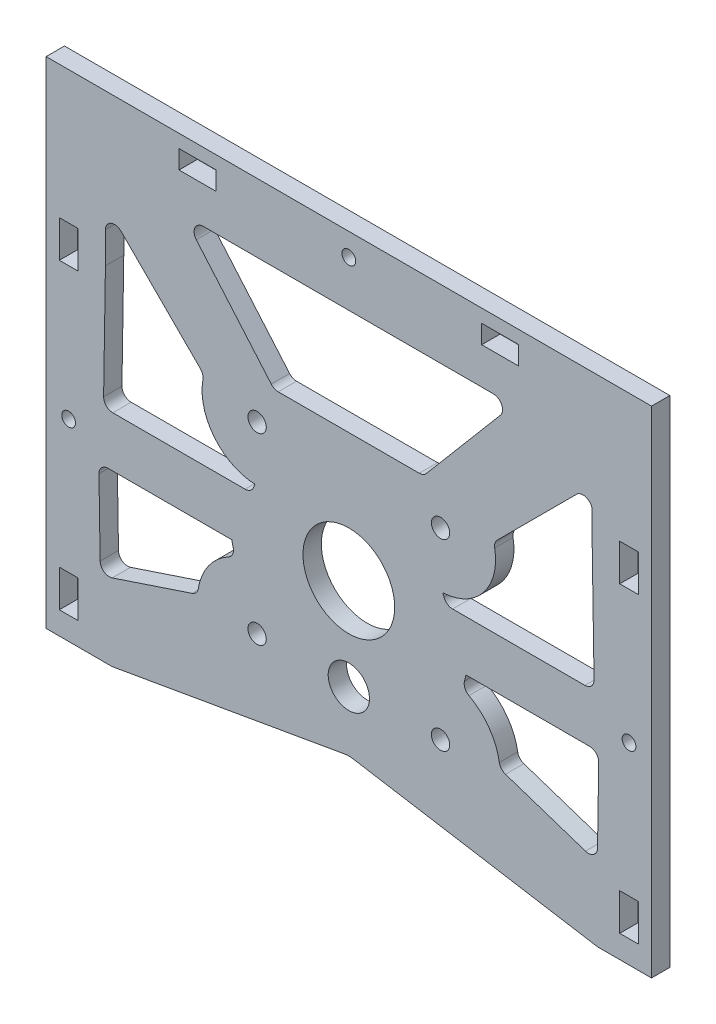
from build123d import *

# Parameters (mm, degrees)
SKETCH_1_R          = 1.5
SKETCH_1_R_2        = 10
SKETCH_1_R_3        = 4.5
SKETCH_1_R_4        = 2
SKETCH_1_W          = 8.05
SKETCH_1_H          = 4.05
SKETCH_1_W_2        = 4.05
SKETCH_1_H_2        = 8.05
EXTRUDE_1_DEPTH     = 4
SKETCH_2_W          = 132
SKETCH_2_H          = 24
CUT_EXTRUDE_1_DEPTH = 4
CUT_EXTRUDE_2_DEPTH = 4


with BuildPart() as part:
    # 草图1 → 凸台-拉伸1 (new body)
    with BuildSketch(Plane.XY):
        Polygon((47.027428163, 101.054738201), (113.027428163, 101.054738201), (113.027428163, -30.945261799), (-18.972571837, -30.945261799), (-18.972571837, 101.054738201), align=None)
        with Locations((47.027428163, 96.155233813)):
            Circle(SKETCH_1_R, mode=Mode.SUBTRACT)
        with Locations((108.127923775, 35.054738201)):
            Circle(SKETCH_1_R, mode=Mode.SUBTRACT)
        with Locations((47.027428163, 35.054738201)):
            Circle(SKETCH_1_R_2, mode=Mode.SUBTRACT)
        with Locations((47.027428163, 15.054738201)):
            Circle(SKETCH_1_R_3, mode=Mode.SUBTRACT)
        with Locations((27.027428163, 15.054738201)):
            Circle(SKETCH_1_R_4, mode=Mode.SUBTRACT)
        with Locations((27.027428163, 55.054738201)):
            Circle(SKETCH_1_R_4, mode=Mode.SUBTRACT)
        with Locations((67.027428163, 55.054738201)):
            Circle(SKETCH_1_R_4, mode=Mode.SUBTRACT)
        with Locations((67.027428163, 15.054738201)):
            Circle(SKETCH_1_R_4, mode=Mode.SUBTRACT)
        with Locations((47.027428163, -26.045757411)):
            Circle(SKETCH_1_R, mode=Mode.SUBTRACT)
        with Locations((-14.073067448, 35.054738201)):
            Circle(SKETCH_1_R, mode=Mode.SUBTRACT)
        with Locations((14.027428163, 96.155233813)):
            Rectangle(SKETCH_1_W, SKETCH_1_H, mode=Mode.SUBTRACT)
        with Locations((80.027428163, 96.155233813)):
            Rectangle(SKETCH_1_W, SKETCH_1_H, mode=Mode.SUBTRACT)
        with Locations((108.127923775, 68.054738201)):
            Rectangle(SKETCH_1_W_2, SKETCH_1_H_2, mode=Mode.SUBTRACT)
        with Locations((108.127923775, 2.054738201)):
            Rectangle(SKETCH_1_W_2, SKETCH_1_H_2, mode=Mode.SUBTRACT)
        with Locations((80.027428163, -26.045757411)):
            Rectangle(SKETCH_1_W, SKETCH_1_H, mode=Mode.SUBTRACT)
        with Locations((14.027428163, -26.045757411)):
            Rectangle(SKETCH_1_W, SKETCH_1_H, mode=Mode.SUBTRACT)
        with Locations((-14.073067448, 2.054738201)):
            Rectangle(SKETCH_1_W_2, SKETCH_1_H_2, mode=Mode.SUBTRACT)
        with Locations((-14.073067448, 68.054738201)):
            Rectangle(SKETCH_1_W_2, SKETCH_1_H_2, mode=Mode.SUBTRACT)
    extrude(amount=EXTRUDE_1_DEPTH)

    # 草图2 → 切除-拉伸1 (cut)
    with BuildSketch(Plane(origin=(0, 0, 0), x_dir=(-1, 0, 0), z_dir=(0, 0, -1))):
        with Locations((-47.027428163, -18.945261799)):
            Rectangle(SKETCH_2_W, SKETCH_2_H)
    extrude(amount=-CUT_EXTRUDE_1_DEPTH, mode=Mode.SUBTRACT)

    # 草图3 → 切除-拉伸2 (cut)
    with BuildSketch(Plane(origin=(0, 0, 0), x_dir=(-1, 0, 0), z_dir=(0, 0, -1))):
        with BuildLine():
            Line((-72.542129808, 30.054738201), (-99.515674348, 30.054738201))
            ThreePointArc((-99.515674348, 30.054738201), (-100.941091534, 29.457658671), (-101.515421297, 28.022924045))
            Line((-101.515421297, 28.022924045), (-101.255391029, 11.678164385))
            ThreePointArc((-101.255391029, 11.678164385), (-100.412595688, 10.078579455), (-98.624288606, 9.812245613))
            Line((-98.624288606, 9.812245613), (-81.193952996, 15.611132086))
            ThreePointArc((-81.193952996, 15.611132086), (-80.304662874, 16.20977419), (-79.852257763, 17.181648105))
            ThreePointArc((-79.852257763, 17.181648105), (-77.616411007, 22.596186492), (-73.230421996, 26.4793987))
            ThreePointArc((-73.230421996, 26.4793987), (-72.353458134, 27.433018894), (-72.244921555, 28.724017307))
            ThreePointArc((-72.244921555, 28.724017307), (-72.402250484, 29.387429123), (-72.542129808, 30.054738201))
        make_face()
        with BuildLine():
            Line((-12.86090333, 15.611132086), (4.569432279, 9.812245613))
            ThreePointArc((4.569432279, 9.812245613), (6.357739361, 10.078579455), (7.200534703, 11.678164385))
            Line((7.200534703, 11.678164385), (7.46056497, 28.022924045))
            ThreePointArc((7.46056497, 28.022924045), (6.886235208, 29.457658671), (5.460818021, 30.054738201))
            Line((5.460818021, 30.054738201), (-21.512726519, 30.054738201))
            ThreePointArc((-21.512726519, 30.054738201), (-21.652605842, 29.387429123), (-21.809934772, 28.724017307))
            ThreePointArc((-21.809934772, 28.724017307), (-21.701398193, 27.433018894), (-20.824434331, 26.4793987))
            ThreePointArc((-20.824434331, 26.4793987), (-16.438445319, 22.596186492), (-14.202598564, 17.181648105))
            ThreePointArc((-14.202598564, 17.181648105), (-13.750193453, 16.20977419), (-12.86090333, 15.611132086))
        make_face()
        with BuildLine():
            Line((4.569432279, -6.945261799), (-101.255391029, -6.945261799))
            Line((-101.255391029, -6.945261799), (-47.866918263, 1.915411357))
            ThreePointArc((-47.866918263, 1.915411357), (-47.027723842, 1.98284019), (-46.189112393, 1.908511437))
            Line((-46.189112393, 1.908511437), (4.569432279, -6.945261799))
        make_face()
        with BuildLine():
            Line((-24.400011165, 41.054738201), (4.444782388, 41.054738201))
            ThreePointArc((4.444782388, 41.054738201), (5.870199575, 41.651817731), (6.444529337, 43.086552357))
            Line((6.444529337, 43.086552357), (6.048067448, 68.007013948))
            Line((6.048067448, 68.007013948), (6.048067448, 74.816525314))
            ThreePointArc((6.048067448, 74.816525314), (4.813434313, 76.664284379), (2.633853886, 76.230738876))
            Line((2.633853886, 76.230738876), (-14.660749072, 58.936135918))
            ThreePointArc((-14.660749072, 58.936135918), (-15.154755521, 58.120835026), (-15.21523446, 57.169467477))
            ThreePointArc((-15.21523446, 57.169467477), (-17.669451156, 47.54286318), (-26.537436176, 43.064746214))
            ThreePointArc((-26.537436176, 43.064746214), (-26.408756591, 42.727441936), (-26.285629249, 42.388071534))
            ThreePointArc((-26.285629249, 42.388071534), (-25.554711704, 41.421745039), (-24.400011165, 41.054738201))
        make_face()
        with BuildLine():
            Line((-100.102923775, 68.007013948), (-100.102923775, 74.816525314))
            ThreePointArc((-100.102923775, 74.816525314), (-98.86829064, 76.664284379), (-96.688710213, 76.230738876))
            Line((-96.688710213, 76.230738876), (-79.394107255, 58.936135918))
            ThreePointArc((-79.394107255, 58.936135918), (-78.900100806, 58.120835026), (-78.839621867, 57.169467477))
            ThreePointArc((-78.839621867, 57.169467477), (-76.385405171, 47.54286318), (-67.517420151, 43.064746214))
            ThreePointArc((-67.517420151, 43.064746214), (-67.646099736, 42.727441936), (-67.769227078, 42.388071534))
            ThreePointArc((-67.769227078, 42.388071534), (-68.500144623, 41.421745039), (-69.654845161, 41.054738201))
            Line((-69.654845161, 41.054738201), (-98.499638715, 41.054738201))
            ThreePointArc((-98.499638715, 41.054738201), (-99.925055902, 41.651817731), (-100.499385664, 43.086552357))
            Line((-100.499385664, 43.086552357), (-100.102923775, 68.007013948))
        make_face()
        with BuildLine():
            Line((-13.7697462, 82.829128974), (-30.109761047, 63.753633363))
            ThreePointArc((-30.109761047, 63.753633363), (-30.792684258, 63.237843917), (-31.628683757, 63.054738201))
            Line((-31.628683757, 63.054738201), (-62.390490848, 63.054738201))
            ThreePointArc((-62.390490848, 63.054738201), (-63.231829728, 63.240310222), (-63.917039651, 63.762589312))
            Line((-63.917039651, 63.762589312), (-80.063513586, 82.838084924))
            ThreePointArc((-80.063513586, 82.838084924), (-80.351392761, 84.971572693), (-78.536964783, 86.130233813))
            Line((-78.536964783, 86.130233813), (-15.28866891, 86.130233813))
            ThreePointArc((-15.28866891, 86.130233813), (-13.471774627, 84.966233311), (-13.7697462, 82.829128974))
        make_face()
    extrude(amount=-CUT_EXTRUDE_2_DEPTH, mode=Mode.SUBTRACT)


solid = part.part
